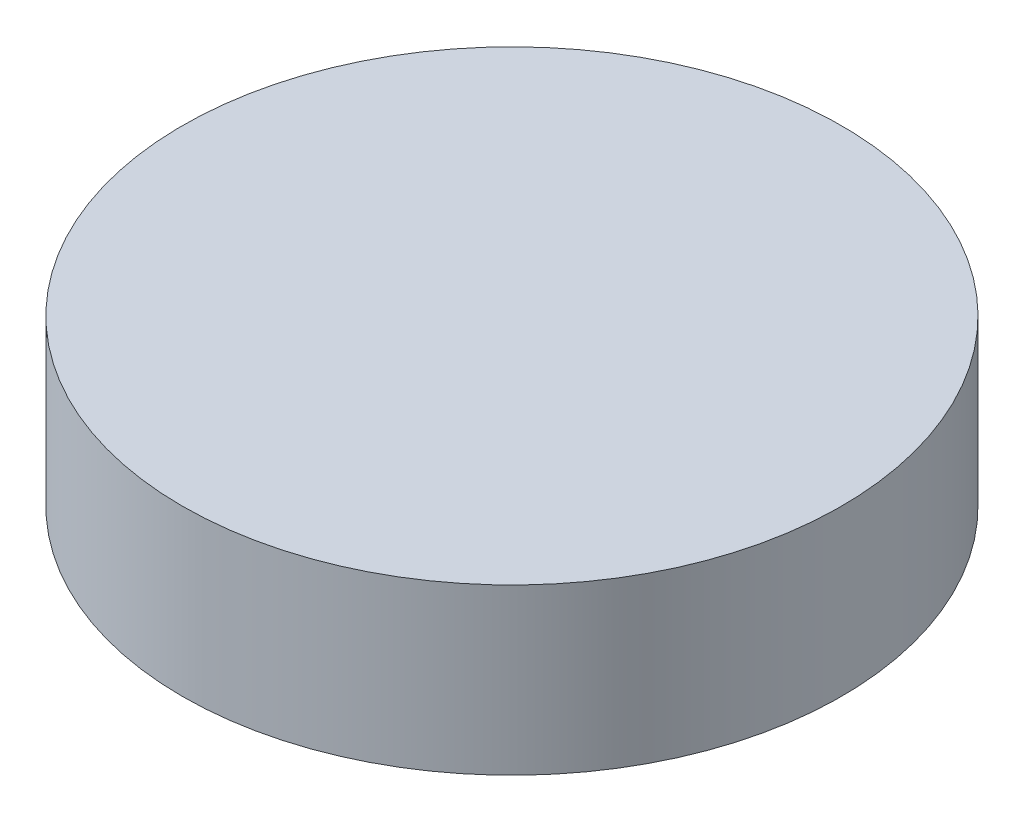
from build123d import *

# Parameters (mm, degrees)
SKETCH1_R           = 50.8
BOSS_EXTRUDE1_DEPTH = 25.4


with BuildPart() as part:
    # Sketch1 → Boss-Extrude1 (new body)
    with BuildSketch(Plane(origin=(0, 0, 0), x_dir=(1, 0, 0), z_dir=(0, 1, 0))):
        with Locations(Location((0, 0, 0), (0, 0, 270))):
            Circle(SKETCH1_R)
    extrude(amount=BOSS_EXTRUDE1_DEPTH)


solid = part.part
